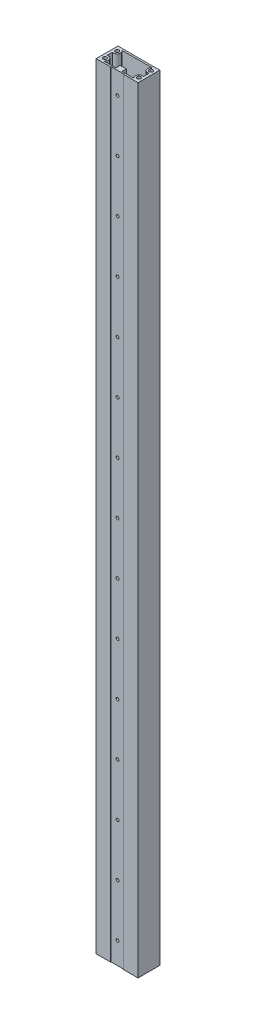
from build123d import *

# Parameters (mm, degrees)
SKETCH_1_W             = 48
SKETCH_1_H             = 25
EXTRUDE_1_DEPTH        = 445
SKETCH_2_R             = 1.9
CUT_EXTRUDE_1_DEPTH    = 891.411281375
SKETCH_3_W             = 15
SKETCH_3_H             = 0.5
CUT_EXTRUDE_2_DEPTH    = 891.411281375
PATTERN_LINEAR_1_COUNT = 15
PATTERN_LINEAR_1_PITCH = 60
CUT_EXTRUDE_3_DEPTH    = 2
M5X0_8_1_AT_2_COUNT    = 2
M5X0_8_1_AT_2_PITCH    = 14
M5X0_8_1_AT_3_COUNT    = 2
M5X0_8_1_AT_3_PITCH    = 39
M5X0_8_1_AT_4_COUNT    = 2
M5X0_8_1_AT_4_PITCH    = 41.43669871


with BuildPart() as part:
    # 草图1 → 凸台-拉伸1 (new, symmetric)
    with BuildSketch(Plane(origin=(0, 0, 0), x_dir=(1, 0, 0), z_dir=(0, 1, 0))):
        Rectangle(SKETCH_1_W, SKETCH_1_H)
    extrude(amount=EXTRUDE_1_DEPTH, both=True)

    # 草图2 → 切除-拉伸1 (cut, through all)
    with BuildSketch(Plane.XZ.offset(445)):
        with Locations(Location((-19.5, 7, 0), (0, 0, 270))):
            Circle(SKETCH_2_R)
        with Locations(Location((-19.5, -7, 0), (0, 0, 90))):
            Circle(SKETCH_2_R)
        with Locations(Location((19.5, -7, 0), (0, 0, 270))):
            Circle(SKETCH_2_R)
        with Locations(Location((19.5, 7, 0), (0, 0, 90))):
            Circle(SKETCH_2_R)
        with BuildLine():
            Line((-17.563508327, 10.5), (-3.5, 10.5))
            Line((-3.5, 10.5), (-3.5, 5.5))
            Line((-3.5, 5.5), (3.5, 5.5))
            Line((3.5, 5.5), (3.5, 10.5))
            Line((3.5, 10.5), (17.563508327, 10.5))
            ThreePointArc((17.563508327, 10.5), (15.889348408, 5.278606646), (21, 3.291900756))
            Line((21, 3.291900756), (21, -3.291900756))
            ThreePointArc((21, -3.291900756), (15.889348408, -5.278606646), (17.563508327, -10.5))
            Line((17.563508327, -10.5), (-17.563508327, -10.5))
            ThreePointArc((-17.563508327, -10.5), (-15.889348408, -5.278606646), (-21, -3.291900756))
            Line((-21, -3.291900756), (-21, 3.291900756))
            ThreePointArc((-21, 3.291900756), (-15.889348408, 5.278606646), (-17.563508327, 10.5))
        make_face()
    extrude(amount=-CUT_EXTRUDE_1_DEPTH, mode=Mode.SUBTRACT)

    # 草图3 → 切除-拉伸2 (cut, through all)
    with BuildSketch(Plane.XZ.offset(445)):
        with Locations((0, 12.25)):
            Rectangle(SKETCH_3_W, SKETCH_3_H)
    extrude(amount=-CUT_EXTRUDE_2_DEPTH, mode=Mode.SUBTRACT)

    # 草图4 → M4x0.7 螺纹孔1 (revolve, cut)
    with BuildSketch(Plane(origin=(0, 420, 12), x_dir=(0, -1, 0), z_dir=(1, 0, 0))):
        Polygon((0, 0), (0, 11.091420021), (1.65, 10.1), (1.65, 0), align=None)
    m4x0_7_1 = revolve(axis=Axis((0, 420, 18.35), (0, 0, -1)), mode=Mode.SUBTRACT)

    # 阵列(线性)1: M4x0.7 螺纹孔1 ×15
    with Locations(*[(0, -i * PATTERN_LINEAR_1_PITCH, 0) for i in range(1, PATTERN_LINEAR_1_COUNT)]):
        add(m4x0_7_1, mode=Mode.SUBTRACT)

    # 草图6 → 切除-拉伸3 (cut)
    with BuildSketch(Plane(origin=(0, 0, -12.5), x_dir=(-1, 0, 0), z_dir=(0, 0, -1))):
        with BuildLine():
            Line((10, -400), (10, -445))
            ThreePointArc((10, -445), (0, -455), (-10, -445))
            Line((-10, -445), (-10, -400))
            ThreePointArc((-10, -400), (0, -390), (10, -400))
        make_face()
    extrude(amount=-CUT_EXTRUDE_3_DEPTH, mode=Mode.SUBTRACT)

    # 草图7 → M5x0.8 螺纹孔1 (revolve, cut)
    with BuildSketch(Plane(origin=(-19.5, 445, -7), x_dir=(0, 0, 1), z_dir=(1, 0, 0))):
        Polygon((0, 0), (0, 13.6618073), (2.1, 12.4), (2.1, 0), align=None)
    m5x0_8_1 = revolve(axis=Axis((-19.5, 451.35, -7), (0, -1, 0)), mode=Mode.SUBTRACT)

    # M5x0.8 螺纹孔1 at 2: M5x0.8 螺纹孔1 ×2
    with Locations(*[(0, 0, i * M5X0_8_1_AT_2_PITCH) for i in range(1, M5X0_8_1_AT_2_COUNT)]):
        add(m5x0_8_1, mode=Mode.SUBTRACT)

    # M5x0.8 螺纹孔1 at 3: M5x0.8 螺纹孔1 ×2
    with Locations(*[(i * M5X0_8_1_AT_3_PITCH, 0, 0) for i in range(1, M5X0_8_1_AT_3_COUNT)]):
        add(m5x0_8_1, mode=Mode.SUBTRACT)

    # M5x0.8 螺纹孔1 at 4: M5x0.8 螺纹孔1 ×2
    with Locations(*[Vector(0.9411946707617075, 0, 0.33786475360676677) * (i * M5X0_8_1_AT_4_PITCH) for i in range(1, M5X0_8_1_AT_4_COUNT)]):
        add(m5x0_8_1, mode=Mode.SUBTRACT)

    # 镜向1: M5x0.8 螺纹孔1 across plane
    add(m5x0_8_1.mirror(Plane.ZX), mode=Mode.SUBTRACT)

    # 镜向1 copy 1 sketch → 镜向1 copy 1 (revolve, cut)
    with BuildSketch(Plane(origin=(-19.5, -445, 7), x_dir=(0, 0, 1), z_dir=(1, 0, 0))):
        Polygon((0, 0), (0, -13.6618073), (2.1, -12.4), (2.1, 0), align=None)
    revolve(axis=Axis((-19.5, -451.35, 7), (0, -1, 0)), mode=Mode.SUBTRACT)

    # 镜向1 copy 2 sketch → 镜向1 copy 2 (revolve, cut)
    with BuildSketch(Plane(origin=(19.5, -445, -7), x_dir=(0, 0, 1), z_dir=(1, 0, 0))):
        Polygon((0, 0), (0, -13.6618073), (2.1, -12.4), (2.1, 0), align=None)
    revolve(axis=Axis((19.5, -451.35, -7), (0, -1, 0)), mode=Mode.SUBTRACT)

    # 镜向1 copy 3 sketch → 镜向1 copy 3 (revolve, cut)
    with BuildSketch(Plane(origin=(19.5, -445, 7), x_dir=(0, 0, 1), z_dir=(1, 0, 0))):
        Polygon((0, 0), (0, -13.6618073), (2.1, -12.4), (2.1, 0), align=None)
    revolve(axis=Axis((19.5, -451.35, 7), (0, -1, 0)), mode=Mode.SUBTRACT)


solid = part.part
